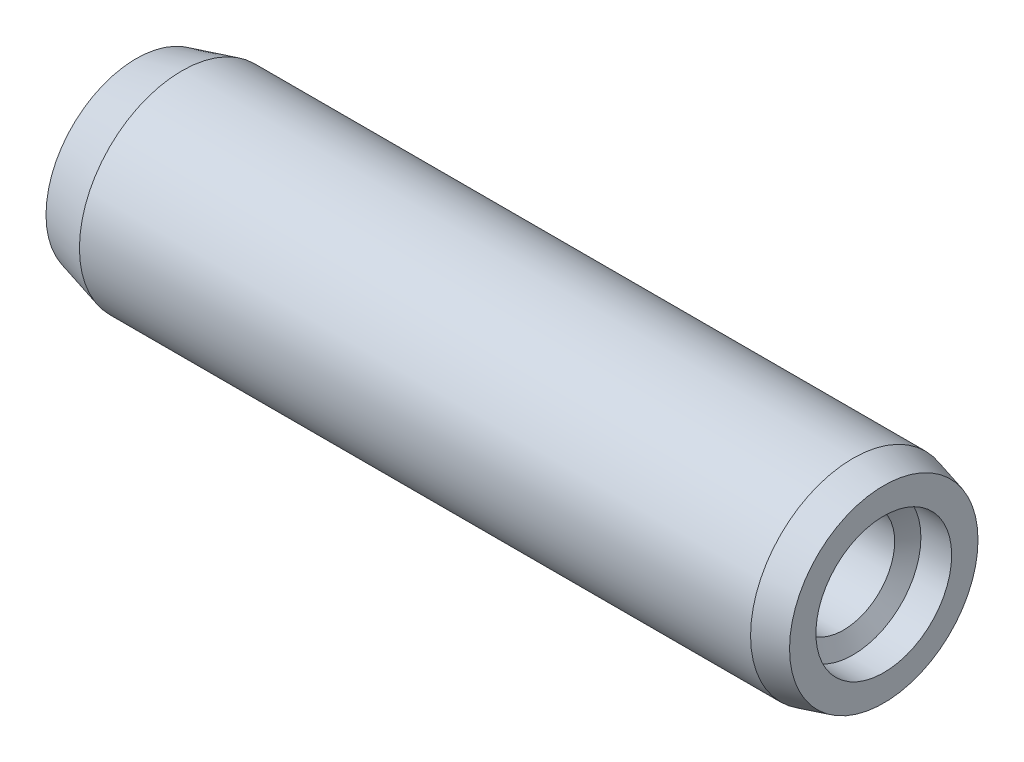
from build123d import *

# Parameters (mm, degrees)
PER_AGE1_D     = 4
PER_AGE1_DEPTH = 12
PER_AGE1_TIP   = 1.154700538
PER_AGE2_D     = 5.3
PER_AGE2_DEPTH = 1.2
PER_AGE2_TIP   = 1.529978213


with BuildPart() as part:
    # Esquisse1 → Base-Révolution (revolve)
    with BuildSketch(Plane.XY, mode=Mode.PRIVATE) as base_r_volution_sk:
        with BuildLine():
            Line((0.817137041, 3.52228331), (2.6, 4))
            Line((2.6, 4), (28.8, 4))
            Line((28.8, 4), (30, 3.678460969))
            Line((30, 3.678460969), (30, 0))
            Line((30, 0), (0, 0))
            ThreePointArc((0, 0), (0.206961322, 1.807912654), (0.817137041, 3.52228331))
        make_face()
    revolve(base_r_volution_sk.sketch.rotate(Axis((-7.062515413, 0, 0), (1, 0, 0)), 90), axis=Axis((-7.062515413, 0, 0), (1, 0, 0)))

    # Perçage1
    with Locations(Plane(origin=(30, 0, 0), x_dir=(0, 0, -1), z_dir=(1, 0, 0))):
        with Locations((0, 0)):
            Hole(PER_AGE1_D / 2, depth=PER_AGE1_DEPTH)
            with Locations((0, 0, -(PER_AGE1_DEPTH + PER_AGE1_TIP / 2))):  # 120° drill point
                Cone(0, PER_AGE1_D / 2, PER_AGE1_TIP, mode=Mode.SUBTRACT)

    # Perçage2
    with Locations(Plane(origin=(30, 0, 0), x_dir=(0, 0, -1), z_dir=(1, 0, 0))):
        with Locations((0, 0)):
            Hole(PER_AGE2_D / 2, depth=PER_AGE2_DEPTH)
            with Locations((0, 0, -(PER_AGE2_DEPTH + PER_AGE2_TIP / 2))):  # 120° drill point
                Cone(0, PER_AGE2_D / 2, PER_AGE2_TIP, mode=Mode.SUBTRACT)


solid = part.part
